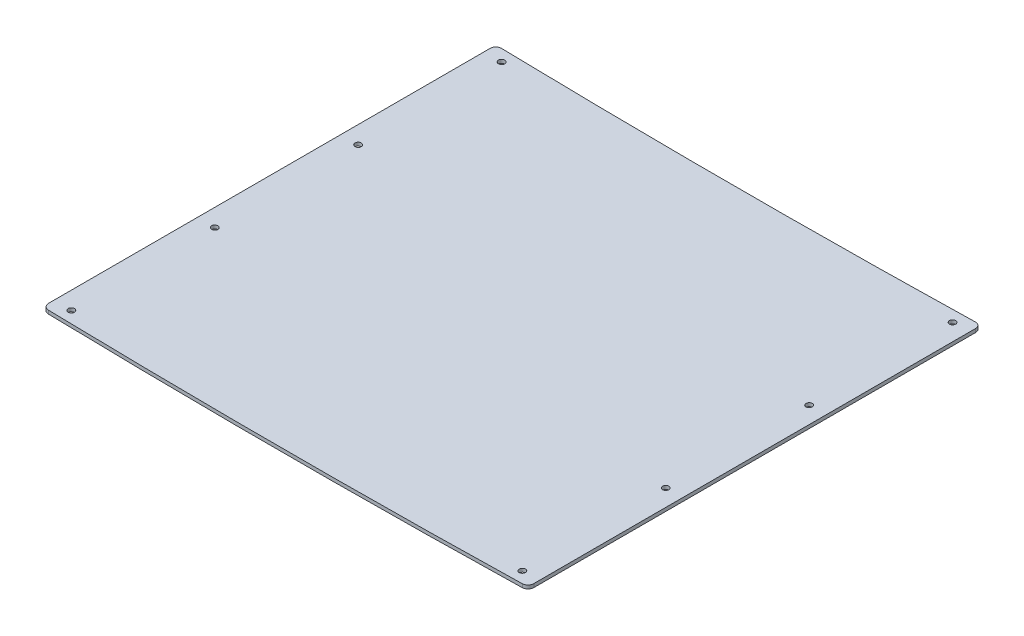
from build123d import *

# Parameters (mm, degrees)
EXTRUS_O_FINA1_DEPTH  = 197.5
FILETE1_R             = 5
ESBO_O2_R             = 2.75
CORTE_EXTRUS_O1_DEPTH = 467.932004441
PADR_O_LINEAR2_COUNT  = 4
PADR_O_LINEAR2_PITCH  = 125


with BuildPart() as part:
    # Esboço1 → Extrusão-Fina1 (new, symmetric)
    with BuildSketch(Plane.XY):
        with BuildLine():
            ThreePointArc((0, 0), (211.5, -2.5), (423, 0))
            Line((423, 0), (423.070912078, -2.999161796))
            ThreePointArc((423.070912078, -2.999161796), (211.5, -5.5), (-0.070912078, -2.999161796))
            Line((-0.070912078, -2.999161796), (0, 0))
        make_face()
    extrude(amount=EXTRUS_O_FINA1_DEPTH, both=True)

    # Filete1
    filete1_edges = [part.edges().sort_by_distance(p)[0] for p in [
        (-0.035456039, -1.499580898, 197.5),
        (-0.035456039, -1.499580898, -197.5),
        (423.035456039, -1.499580898, -197.5),
        (423.035456039, -1.499580898, 197.5),
    ]]
    fillet(filete1_edges, radius=FILETE1_R)

    # Esboço2 → Corte-extrusão1 (cut, through all)
    with BuildSketch(Plane(origin=(0, 0, 0), x_dir=(1, 0, 0), z_dir=(0, 1, 0))):
        with Locations(Location((14.929087922, -187.5, 0), (0, 0, 270))):
            Circle(ESBO_O2_R)
        with Locations(Location((408, -187.5, 0), (0, 0, 270))):
            Circle(ESBO_O2_R)
    corte_extrus_o1 = extrude(amount=-CORTE_EXTRUS_O1_DEPTH, mode=Mode.SUBTRACT)

    # Padrão linear2: Corte-extrusão1 ×4
    with Locations(*[(0, 0, -i * PADR_O_LINEAR2_PITCH) for i in range(1, PADR_O_LINEAR2_COUNT)]):
        add(corte_extrus_o1, mode=Mode.SUBTRACT)


solid = part.part
